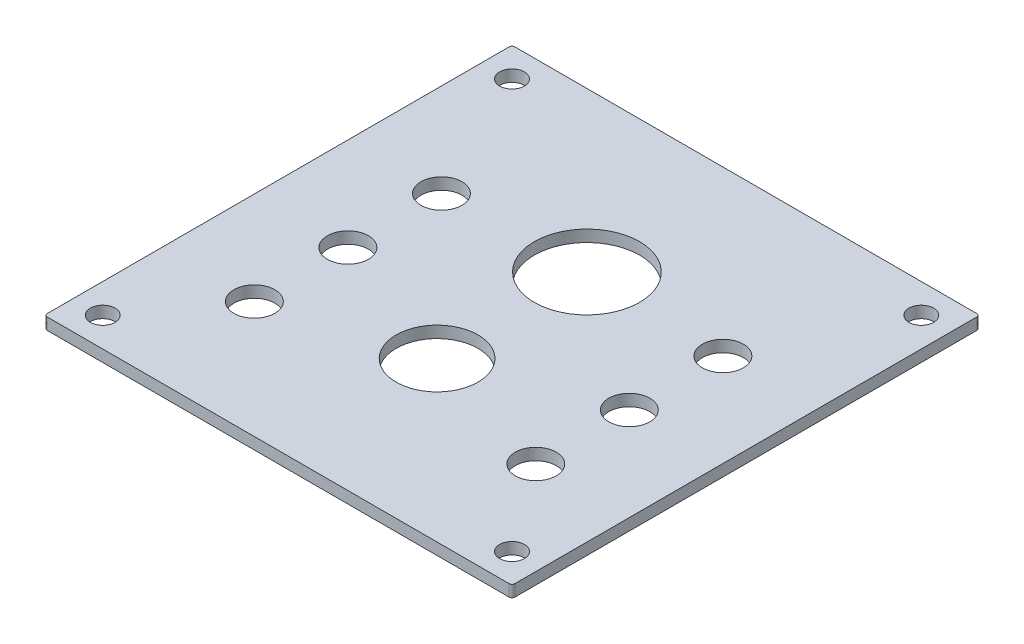
from build123d import *

# Parameters (mm, degrees)
SKETCH1_R           = 5.5626
SKETCH1_R_2         = 3.3528
SKETCH1_R_3         = 11.1125
SKETCH1_R_4         = 14.2875
BOSS_EXTRUDE1_DEPTH = 3.175


with BuildPart() as part:
    # Sketch1 → Boss-Extrude1 (new body)
    with BuildSketch(Plane.XZ.offset(3.175)):
        with BuildLine():
            Line((76.379348237, 48.6897733), (-49.033151763, 48.6897733))
            ThreePointArc((-49.033151763, 48.6897733), (-49.594417771, 48.457289307), (-49.826901763, 47.8960233))
            Line((-49.826901763, 47.8960233), (-49.826901763, -77.5164767))
            ThreePointArc((-49.826901763, -77.5164767), (-49.594417771, -78.077742708), (-49.033151763, -78.3102267))
            Line((-49.033151763, -78.3102267), (76.379348237, -78.3102267))
            ThreePointArc((76.379348237, -78.3102267), (76.940614244, -78.077742708), (77.173098237, -77.5164767))
            Line((77.173098237, -77.5164767), (77.173098237, 47.8960233))
            ThreePointArc((77.173098237, 47.8960233), (76.940614244, 48.457289307), (76.379348237, 48.6897733))
        make_face()
        with Locations(Location((51.881343204, -8.4602267, 0), (0, 0, 270))):
            Circle(SKETCH1_R, mode=Mode.SUBTRACT)
        with Locations(Location((51.881343204, -33.8602267, 0), (0, 0, 270))):
            Circle(SKETCH1_R, mode=Mode.SUBTRACT)
        with Locations(Location((-24.535146731, 16.9397733, 0), (0, 0, 270))):
            Circle(SKETCH1_R, mode=Mode.SUBTRACT)
        with Locations(Location((-41.889401763, 40.7522733, 0), (0, 0, 270))):
            Circle(SKETCH1_R_2, mode=Mode.SUBTRACT)
        with Locations(Location((13.673098237, 5.5351733, 0), (0, 0, 270))):
            Circle(SKETCH1_R_3, mode=Mode.SUBTRACT)
        with Locations(Location((69.235598237, -70.3727267, 0), (0, 0, 270))):
            Circle(SKETCH1_R_2, mode=Mode.SUBTRACT)
        with Locations(Location((69.235598237, 40.7522733, 0), (0, 0, 270))):
            Circle(SKETCH1_R_2, mode=Mode.SUBTRACT)
        with Locations(Location((-41.889401763, -70.3727267, 0), (0, 0, 270))):
            Circle(SKETCH1_R_2, mode=Mode.SUBTRACT)
        with Locations(Location((13.673098237, -35.1556267, 0), (0, 0, 270))):
            Circle(SKETCH1_R_4, mode=Mode.SUBTRACT)
        with Locations(Location((-24.535146731, -8.4602267, 0), (0, 0, 270))):
            Circle(SKETCH1_R, mode=Mode.SUBTRACT)
        with Locations(Location((51.881343204, 16.9397733, 0), (0, 0, 270))):
            Circle(SKETCH1_R, mode=Mode.SUBTRACT)
        with Locations(Location((-24.535146731, -33.8602267, 0), (0, 0, 270))):
            Circle(SKETCH1_R, mode=Mode.SUBTRACT)
    extrude(amount=-BOSS_EXTRUDE1_DEPTH)


solid = part.part
